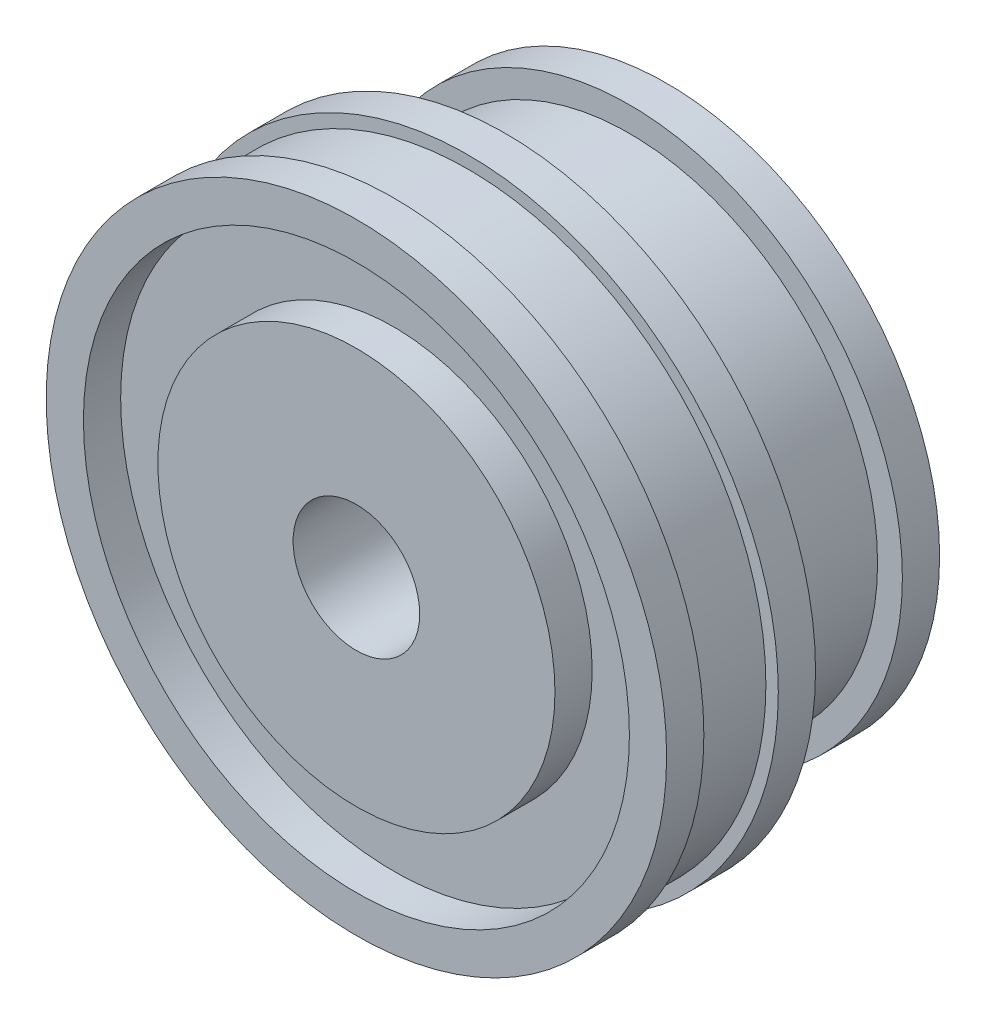
from build123d import *

# Parameters (mm, degrees)
SKETCH1_R              = 22
BOSS_EXTRUDE1_DEPTH    = 3
SKETCH2_R              = 20
BOSS_EXTRUDE2_DEPTH    = 10
SKETCH3_R              = 25
BOSS_EXTRUDE3_DEPTH    = 3
SKETCH4_R              = 24
BOSS_EXTRUDE4_DEPTH    = 6
SKETCH5_R              = 25
BOSS_EXTRUDE5_DEPTH    = 3
CUT_EXTRUDE1_START     = -3
SKETCH6_R              = 22
SKETCH6_R_2            = 16
CUT_EXTRUDE1_DEPTH     = 3
SKETCH8_R              = 7
CUT_EXTRUDE2_DEPTH     = 2
M12_TAPPED_HOLE1_D     = 10.2
M12_TAPPED_HOLE1_DEPTH = 19


with BuildPart() as part:
    # Sketch1 → Boss-Extrude1 (new body)
    with BuildSketch(Plane.XY):
        Circle(SKETCH1_R)
    extrude(amount=BOSS_EXTRUDE1_DEPTH)

    # Sketch2 → Boss-Extrude2 (add)
    with BuildSketch(Plane.XY.offset(3)):
        Circle(SKETCH2_R)
    extrude(amount=BOSS_EXTRUDE2_DEPTH)

    # Sketch3 → Boss-Extrude3 (add)
    with BuildSketch(Plane.XY.offset(13)):
        Circle(SKETCH3_R)
    extrude(amount=BOSS_EXTRUDE3_DEPTH)

    # Sketch4 → Boss-Extrude4 (add)
    with BuildSketch(Plane.XY.offset(16)):
        Circle(SKETCH4_R)
    extrude(amount=BOSS_EXTRUDE4_DEPTH)

    # Sketch5 → Boss-Extrude5 (add)
    with BuildSketch(Plane.XY.offset(22)):
        Circle(SKETCH5_R)
    extrude(amount=BOSS_EXTRUDE5_DEPTH)

    # Sketch6 → Cut-Extrude1 (cut)
    with BuildSketch(Plane.XY.offset(25).offset(CUT_EXTRUDE1_START)):
        Circle(SKETCH6_R)
        Circle(SKETCH6_R_2, mode=Mode.SUBTRACT)
    extrude(amount=CUT_EXTRUDE1_DEPTH, mode=Mode.SUBTRACT)

    # Sketch8 → Cut-Extrude2 (cut)
    with BuildSketch(Plane.XY.offset(4)):
        Circle(SKETCH8_R)
    extrude(amount=CUT_EXTRUDE2_DEPTH, mode=Mode.SUBTRACT)

    # M12 Tapped Hole1
    with Locations(Plane.XY.offset(25)):
        with Locations((0, 0)):
            Hole(M12_TAPPED_HOLE1_D / 2, depth=M12_TAPPED_HOLE1_DEPTH)


solid = part.part
